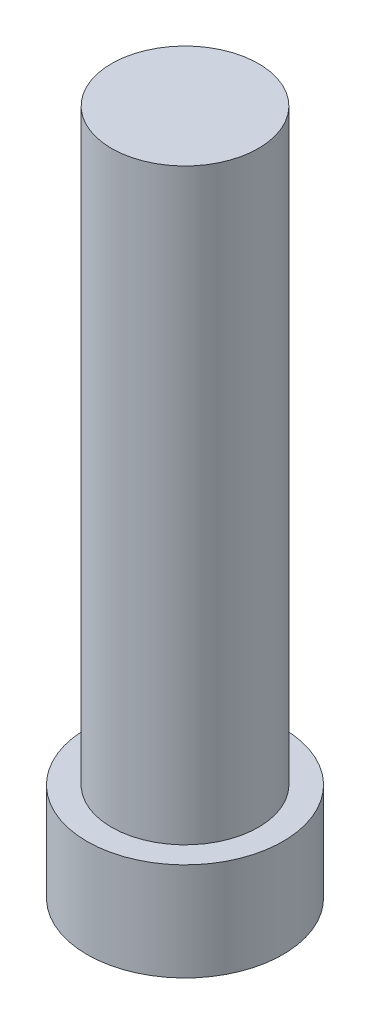
from build123d import *

# Parameters (mm, degrees)
SKETCH2_R           = 10
BOSS_EXTRUDE1_DEPTH = 10
SKETCH3_R           = 7.5
BOSS_EXTRUDE2_DEPTH = 60


with BuildPart() as part:
    # Sketch2 → Boss-Extrude1 (new body)
    with BuildSketch(Plane(origin=(0, 0, 0), x_dir=(1, 0, 0), z_dir=(0, 1, 0))):
        with Locations(Location((0, 0, 0), (0, 0, 270))):
            Circle(SKETCH2_R)
    extrude(amount=BOSS_EXTRUDE1_DEPTH)

    # Sketch3 → Boss-Extrude2 (add)
    with BuildSketch(Plane(origin=(0, 10, 0), x_dir=(1, 0, 0), z_dir=(0, 1, 0))):
        with Locations(Location((0, 0, 0), (0, 0, 270))):
            Circle(SKETCH3_R)
    extrude(amount=BOSS_EXTRUDE2_DEPTH)


solid = part.part
